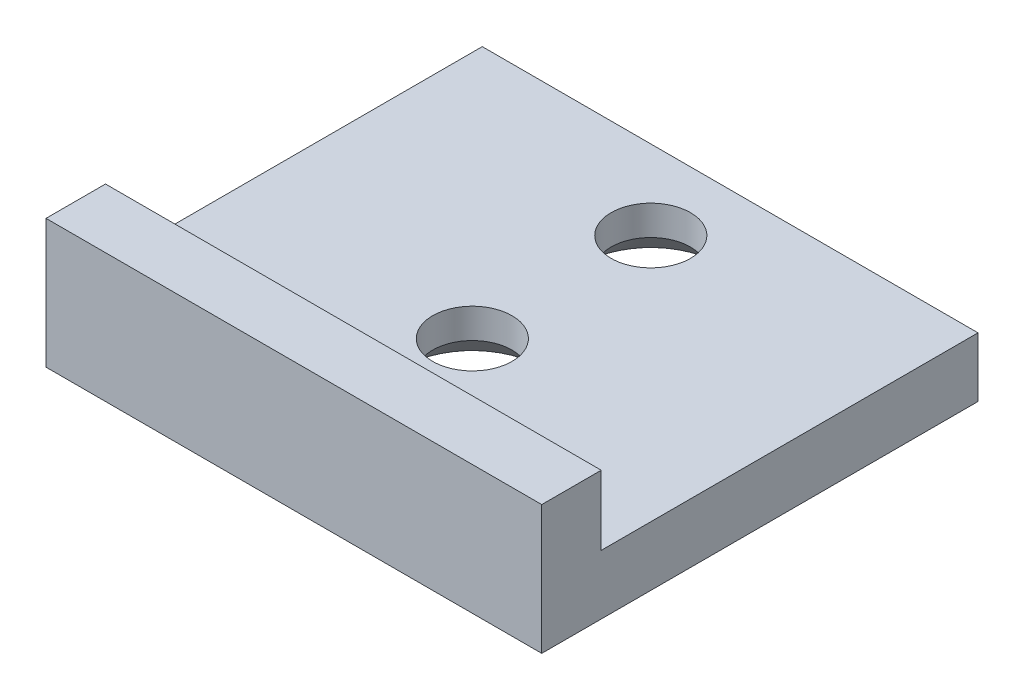
from build123d import *

# Parameters (mm, degrees)
SKETCH1_W             = 50
SKETCH1_H             = 44
BOSS_EXTRUDE1_DEPTH   = 6.5
SKETCH2_W             = 38
SKETCH2_H             = 7
CUT_EXTRUDE1_DEPTH    = 56.011362463
F_8_0MM_DOWEL_HOLE1_D = 8
CHAMFER1_SIZE         = 3


with BuildPart() as part:
    # Sketch1 → Boss-Extrude1 (new, symmetric)
    with BuildSketch(Plane(origin=(0, 0, 0), x_dir=(1, 0, 0), z_dir=(0, 1, 0))):
        Rectangle(SKETCH1_W, SKETCH1_H)
    extrude(amount=BOSS_EXTRUDE1_DEPTH, both=True)

    # Sketch2 → Cut-Extrude1 (cut, through all)
    with BuildSketch(Plane(origin=(25, 0, 0), x_dir=(0, 0, -1), z_dir=(1, 0, 0))):
        with Locations((3, 3)):
            Rectangle(SKETCH2_W, SKETCH2_H)
    extrude(amount=-CUT_EXTRUDE1_DEPTH, mode=Mode.SUBTRACT)

    # Ø8.0mm Dowel Hole1 (through all)
    with Locations(Plane(origin=(0, -6.5, 0), x_dir=(-1, 0, 0), z_dir=(0, -1, 0))):
        with Locations((0, 14), (0, -4)):
            Hole(F_8_0MM_DOWEL_HOLE1_D / 2)

    # Chamfer1
    chamfer1_edges = [part.edges().sort_by_distance(p)[0] for p in [
        (-4, -6.5, 4),
        (-4, -6.5, -14),
    ]]
    chamfer(chamfer1_edges, length=CHAMFER1_SIZE)


solid = part.part
